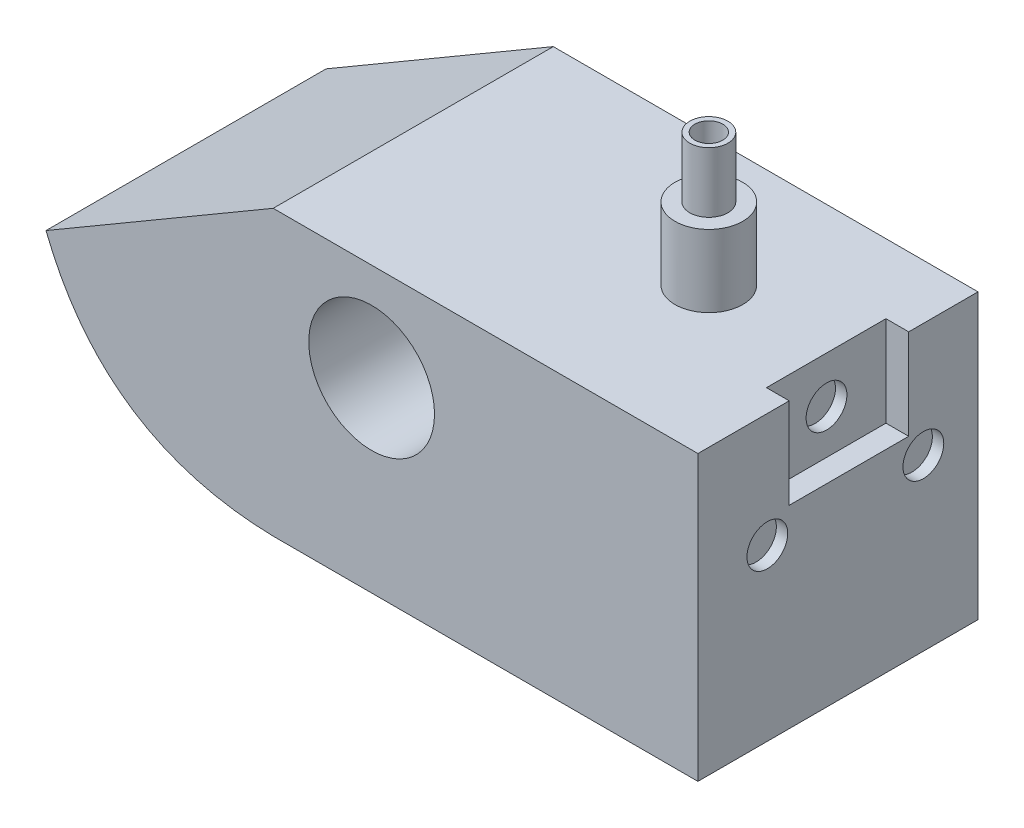
from build123d import *

# Parameters (mm, degrees)
SKETCH2_W               = 74.64
SKETCH2_H               = 49.9
SKETCH2_R               = 11.05
BOSS_EXTRUDE3_DEPTH     = 49.22
BOSS_EXTRUDE4_DEPTH     = 49.22
SKETCH7_R               = 5.95
BOSS_EXTRUDE5_DEPTH     = 12.67
SKETCH8_R               = 3.35
BOSS_EXTRUDE6_DEPTH     = 10.6
SKETCH9_R               = 2.447157839
CUT_EXTRUDE1_DEPTH      = 4
CUT_EXTRUDE2_DEPTH      = 145.004745584
CUT_EXTRUDE2_DEPTH_BACK = 4
SKETCH11_R              = 3.585
CUT_EXTRUDE3_DEPTH      = 2
SKETCH12_R              = 3.585
CUT_EXTRUDE4_DEPTH      = 2
SKETCH13_R              = 3.585
CUT_EXTRUDE5_DEPTH      = 2


with BuildPart() as part:
    # Sketch2 → Boss-Extrude3 (new body)
    with BuildSketch(Plane.XY):
        with Locations((-36.171052169, 23.819106833)):
            Rectangle(SKETCH2_W, SKETCH2_H)
        with Locations((-56.191052169, 31.609453319)):
            Circle(SKETCH2_R, mode=Mode.SUBTRACT)
    extrude(amount=BOSS_EXTRUDE3_DEPTH)

    # Sketch3 → Boss-Extrude4 (add)
    with BuildSketch(Plane.XY):
        with BuildLine():
            Line((-73.491052169, 48.769106833), (-113.415991852, 25.422550529))
            add(Edge.make_bspline(
                [(-73.491052169, -1.130893167), (-103.22071341, -0.46361186), (-113.415991852, 25.422550529)],
                knots=[0, 0, 0, 1, 1, 1], degree=2))
            Line((-73.491052169, -1.130893167), (-73.491052169, 48.769106833))
        make_face()
    extrude(amount=BOSS_EXTRUDE4_DEPTH)

    # Sketch7 → Boss-Extrude5 (add)
    with BuildSketch(Plane(origin=(0, 48.769106833, 0), x_dir=(1, 0, 0), z_dir=(0, 1, 0))):
        with Locations(Location((-23.531052169, -22.62, 0), (0, 0, 90))):
            Circle(SKETCH7_R)
    extrude(amount=BOSS_EXTRUDE5_DEPTH)

    # Sketch8 → Boss-Extrude6 (add)
    with BuildSketch(Plane(origin=(0, 61.439106833, 0), x_dir=(1, 0, 0), z_dir=(0, 1, 0))):
        with Locations(Location((-23.531052169, -22.62, 0), (0, 0, 270))):
            Circle(SKETCH8_R)
    extrude(amount=BOSS_EXTRUDE6_DEPTH)

    # Sketch9 → Cut-Extrude1 (cut)
    with BuildSketch(Plane(origin=(0, 72.039106833, 0), x_dir=(1, 0, 0), z_dir=(0, 1, 0))):
        with Locations(Location((-23.531052169, -22.62, 0), (0, 0, 270))):
            Circle(SKETCH9_R)
    extrude(amount=-CUT_EXTRUDE1_DEPTH, mode=Mode.SUBTRACT)

    # Sketch10 → Cut-Extrude2 (cut, two sides: drawn at the far end of the back side and taken through both)
    with BuildSketch(Plane(origin=(1.148947831, 0, 0), x_dir=(0, 0, -1), z_dir=(1, 0, 0)).offset(-CUT_EXTRUDE2_DEPTH_BACK)):
        Polygon((-33.176264777, 183.063086359), (-33.176264777, 48.769106833), (-33.176264777, 32.869106833), (-12.176264777, 32.869106833), (-12.176264777, 48.769106833), (-12.176264777, 183.063086359), (-12.176264777, 451.651045412), (-33.176264777, 451.651045412), align=None)
    extrude(amount=CUT_EXTRUDE2_DEPTH + CUT_EXTRUDE2_DEPTH_BACK, mode=Mode.SUBTRACT)

    # Sketch11 → Cut-Extrude3 (cut)
    with BuildSketch(Plane(origin=(-2.851052169, 0, 0), x_dir=(0, 0, -1), z_dir=(1, 0, 0))):
        with Locations(Location((-22.624143427, 40.627842238, 0), (0, 0, 90))):
            Circle(SKETCH11_R)
    extrude(amount=-CUT_EXTRUDE3_DEPTH, mode=Mode.SUBTRACT)

    # Sketch12 → Cut-Extrude4 (cut)
    with BuildSketch(Plane(origin=(1.148947831, 0, 0), x_dir=(0, 0, -1), z_dir=(1, 0, 0))):
        with Locations(Location((-9.6, 28.719106833, 0), (0, 0, 90))):
            Circle(SKETCH12_R)
    extrude(amount=-CUT_EXTRUDE4_DEPTH, mode=Mode.SUBTRACT)

    # Sketch13 → Cut-Extrude5 (cut)
    with BuildSketch(Plane(origin=(1.148947831, 0, 0), x_dir=(0, 0, -1), z_dir=(1, 0, 0))):
        with Locations(Location((-37.02, 28.719106833, 0), (0, 0, 90))):
            Circle(SKETCH13_R)
    extrude(amount=-CUT_EXTRUDE5_DEPTH, mode=Mode.SUBTRACT)


solid = part.part
